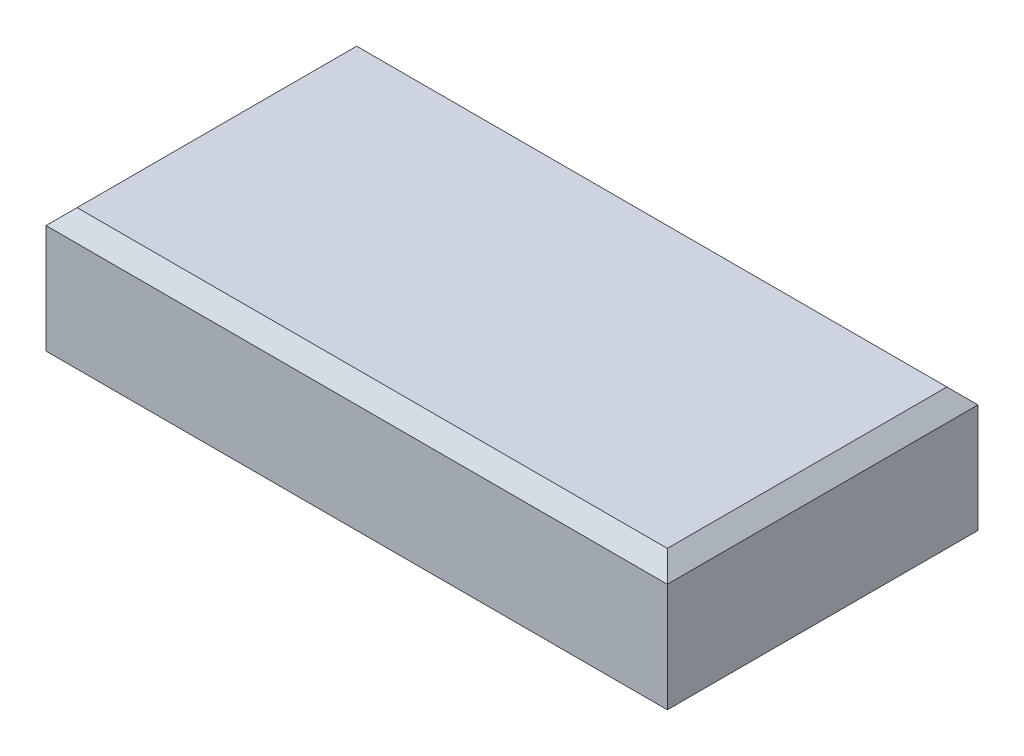
from build123d import *

# Parameters (mm, degrees)
SKETCH1_W           = 40
SKETCH1_H           = 20
BOSS_EXTRUDE1_DEPTH = 8
CHAMFER1_SIZE       = 1


with BuildPart() as part:
    # Sketch1 → Boss-Extrude1 (new body)
    with BuildSketch(Plane(origin=(0, 0, 0), x_dir=(1, 0, 0), z_dir=(0, 1, 0))):
        with Locations((0, 2.318501171)):
            Rectangle(SKETCH1_W, SKETCH1_H)
    extrude(amount=BOSS_EXTRUDE1_DEPTH)

    # Chamfer1
    chamfer1_edges = [part.edges().sort_by_distance(p)[0] for p in [
        (-20, 8, -2.318501171),
        (0, 8, 7.681498829),
        (20, 8, -2.318501171),
        (0, 8, -12.318501171),
    ]]
    chamfer(chamfer1_edges, length=CHAMFER1_SIZE)


solid = part.part
